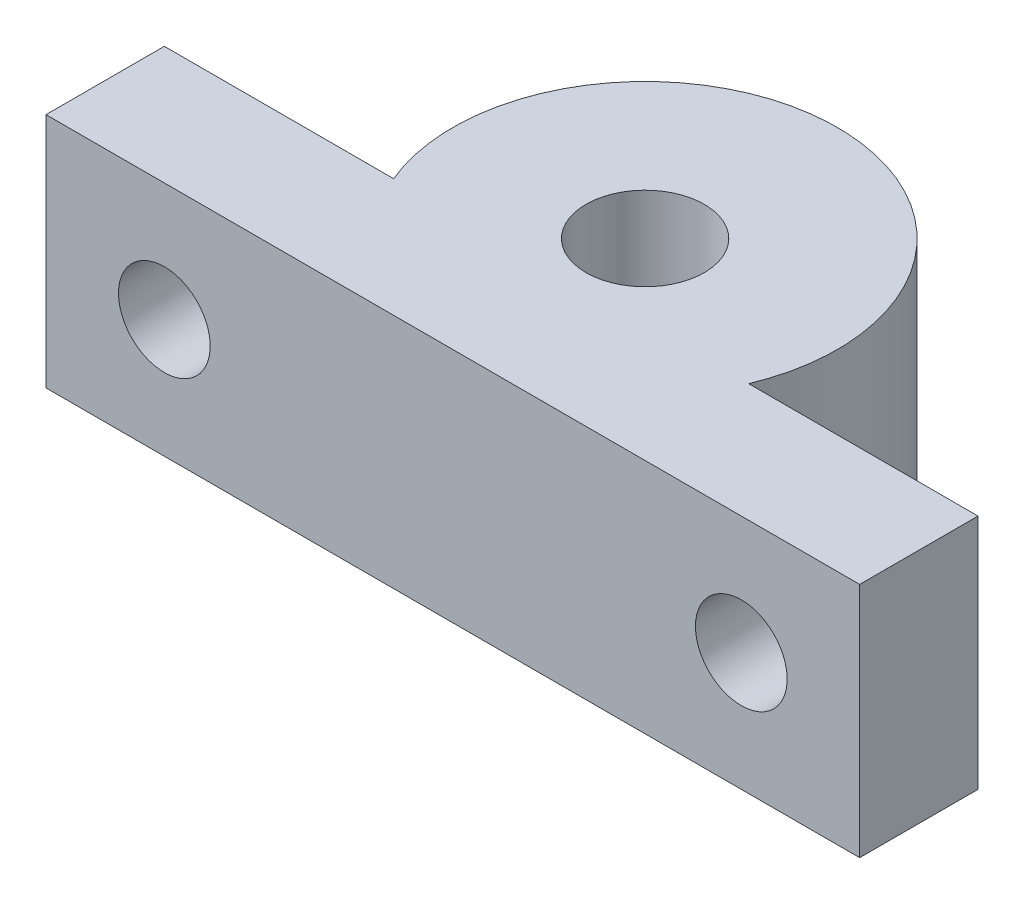
from build123d import *

# Parameters (mm, degrees)
SKETCH1_R           = 6.5
BOSS_EXTRUDE1_DEPTH = 8
SKETCH3_W           = 27.5
SKETCH3_H           = 8
BOSS_EXTRUDE2_DEPTH = 4
CUT_EXTRUDE1_REACH  = 19.185
SKETCH4_R           = 2
CUT_EXTRUDE2_REACH  = 20.277
SKETCH5_R           = 1.55


with BuildPart() as part:
    # Sketch1 → Boss-Extrude1 (new body)
    with BuildSketch(Plane(origin=(0, 0, 0), x_dir=(1, 0, 0), z_dir=(0, 1, 0))):
        with Locations(Location((0, 0, 0), (0, 0, 270))):
            Circle(SKETCH1_R)
    extrude(amount=BOSS_EXTRUDE1_DEPTH)

    # Sketch3 → Boss-Extrude2 (add)
    with BuildSketch(Plane(origin=(0, 8, 6.5), x_dir=(1, 0, 0), z_dir=(0, 0, 1))):
        with Locations((0, -4)):
            Rectangle(SKETCH3_W, SKETCH3_H)
    extrude(amount=-BOSS_EXTRUDE2_DEPTH)

    # Sketch4 → Cut-Extrude1 (cut, up to next)
    with BuildSketch(Plane(origin=(0, 8, 0), x_dir=(1, 0, 0), z_dir=(0, 1, 0)), mode=Mode.PRIVATE) as cut_extrude1_sk1:
        with Locations(Location((0, 0, 0), (0, 0, 270))):
            Circle(SKETCH4_R)
    cut_extrude1_tool1 = extrude(cut_extrude1_sk1.sketch, amount=-CUT_EXTRUDE1_REACH, mode=Mode.PRIVATE) & part.part
    add(cut_extrude1_tool1.solids().sort_by_distance((0, 8, 0))[0], mode=Mode.SUBTRACT)

    # Sketch5 → Cut-Extrude2 (cut, up to next)
    with BuildSketch(Plane(origin=(0, 0, 2.5), x_dir=(-1, 0, 0), z_dir=(0, 0, -1)), mode=Mode.PRIVATE) as cut_extrude2_sk1:
        with Locations((9.75, 4)):
            Circle(SKETCH5_R)
    cut_extrude2_tool1 = extrude(cut_extrude2_sk1.sketch, amount=-CUT_EXTRUDE2_REACH, mode=Mode.PRIVATE) & part.part
    # Sketch5 → Cut-Extrude2 (cut, up to next)
    with BuildSketch(Plane(origin=(0, 0, 2.5), x_dir=(-1, 0, 0), z_dir=(0, 0, -1)), mode=Mode.PRIVATE) as cut_extrude2_sk2:
        with Locations((-9.75, 4)):
            Circle(SKETCH5_R)
    cut_extrude2_tool2 = extrude(cut_extrude2_sk2.sketch, amount=-CUT_EXTRUDE2_REACH, mode=Mode.PRIVATE) & part.part
    add(cut_extrude2_tool1.solids().sort_by_distance((-9.75, 4, 2.5))[0], mode=Mode.SUBTRACT)
    add(cut_extrude2_tool2.solids().sort_by_distance((9.75, 4, 2.5))[0], mode=Mode.SUBTRACT)


solid = part.part
